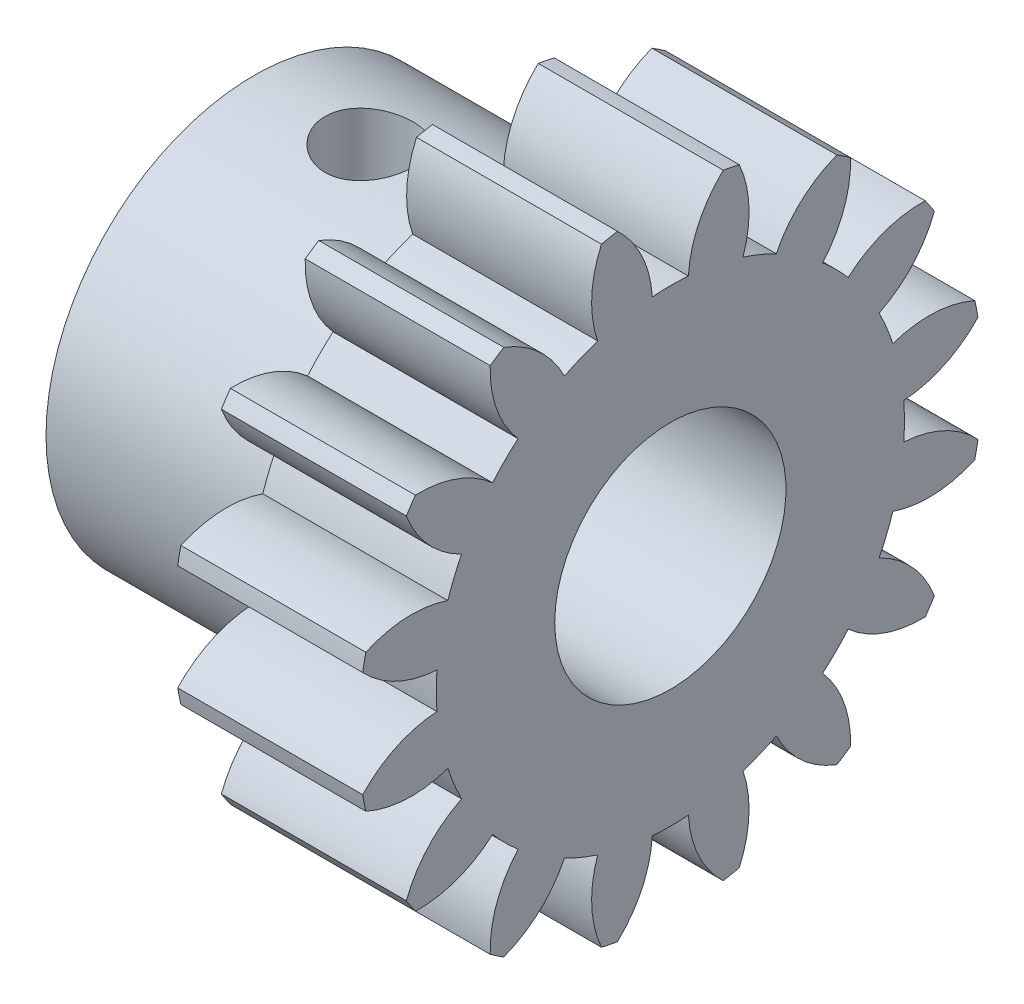
from build123d import *

# Parameters (mm, degrees)
BASPROSKE_W              = 8
BASPROSKE_H              = 13.5
TOOTHCUT_DEPTH           = 21.700241544
TEETHCUTS_COUNT          = 16
TEETHCUTS_ANGLE          = 337.5
HUBNEAONESKE_R           = 9
HUBNEARONE_DEPTH         = 10.0000508
BORSKE_R                 = 5
BORE_DEPTH               = 18.0000508
CUT_EXTRUDE_1_DEPTH      = 22.308194049
CUT_EXTRUDE_1_DEPTH_BACK = 22.308194049
SKETCH_1_R               = 1.9


with BuildPart() as part:
    # BasProSke → Base-Revolve (revolve)
    with BuildSketch(Plane(origin=(0, 0, 0), x_dir=(1, 0, 0), z_dir=(0, 1, 0)), mode=Mode.PRIVATE) as base_revolve_sk:
        with Locations((4, 6.75)):
            Rectangle(BASPROSKE_W, BASPROSKE_H)
    revolve(base_revolve_sk.sketch.rotate(Axis((-10, 0, 0), (1, 0, 0)), 180), axis=Axis((-10, 0, 0), (1, 0, 0)))

    # TooCutSke → ToothCut (cut, through all)
    with BuildSketch(Plane(origin=(0, 0, 0), x_dir=(0, 0, -1), z_dir=(1, 0, 0))):
        with BuildLine():
            ThreePointArc((0.779807897, 10.093922708), (0, 10.124), (-0.779807897, 10.093922708))
            ThreePointArc((-0.779807897, 10.093922708), (-1.232785697, 11.858156262), (-2.310463203, 13.326597651))
            ThreePointArc((-2.310463203, 13.326597651), (0, 13.5254), (2.310463203, 13.326597651))
            ThreePointArc((2.310463203, 13.326597651), (1.232785697, 11.858156262), (0.779807897, 10.093922708))
        make_face()
    toothcut = extrude(amount=TOOTHCUT_DEPTH, mode=Mode.SUBTRACT)

    # TeethCuts: ToothCut ×16 about axis
    teethcuts_axis = Axis((-10, 0, 0), (1, 0, 0))
    for i in range(1, TEETHCUTS_COUNT):
        add(toothcut.rotate(teethcuts_axis, i * TEETHCUTS_ANGLE / (TEETHCUTS_COUNT - 1)), mode=Mode.SUBTRACT)

    # HubNeaOneSke → HubNearOne (add)
    with BuildSketch(Plane.ZY):
        with Locations(Location((0, 0, 0), (0, 0, 180))):
            Circle(HUBNEAONESKE_R)
    extrude(amount=HUBNEARONE_DEPTH)

    # BorSke → Bore (cut, symmetric)
    with BuildSketch(Plane(origin=(0, 0, 0), x_dir=(0, 0, -1), z_dir=(1, 0, 0))):
        with Locations(Location((0, 0, 0), (0, 0, 180))):
            Circle(BORSKE_R)
    extrude(amount=BORE_DEPTH, both=True, mode=Mode.SUBTRACT)

    # 草图1 → 切除-拉伸1 (cut, two sides: drawn at the far end of the back side and taken through both)
    with BuildSketch(Plane(origin=(0, 0, 0), x_dir=(1, 0, 0), z_dir=(0, 1, 0)).offset(-CUT_EXTRUDE_1_DEPTH_BACK)):
        with Locations(Location((-5.028528168, 0, 0), (0, 0, 270))):
            Circle(SKETCH_1_R)
    extrude(amount=CUT_EXTRUDE_1_DEPTH + CUT_EXTRUDE_1_DEPTH_BACK, mode=Mode.SUBTRACT)


solid = part.part
